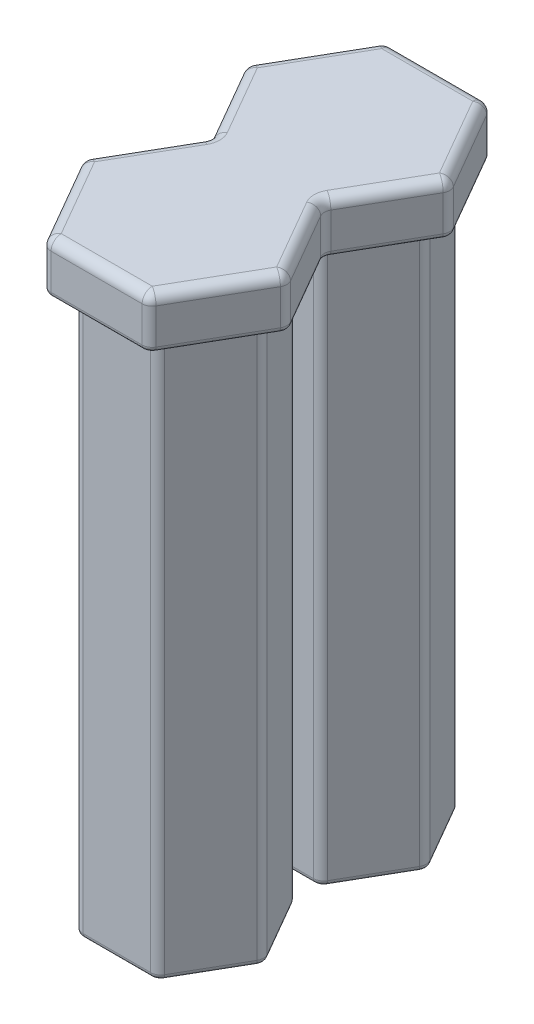
from build123d import *

# Parameters (mm, degrees)
BOSS_EXTRUDE1_DEPTH       = 55
BOSS_EXTRUDE1_2_DEPTH     = 55
BOSS_EXTRUDE2_START       = 55
BOSS_EXTRUDE2_DEPTH       = 5
FILLET1_R                 = 1
FILLET2_R                 = 1
F_4_0MM_DOWEL_HOLE1_D     = 4
F_4_0MM_DOWEL_HOLE1_DEPTH = 20
F_4_0MM_DOWEL_HOLE1_TIP   = 1.201721238
FILLET3_R                 = 0.5


with BuildPart() as part:
    # Sketch1 → Boss-Extrude1 (new body)
    with BuildSketch(Plane(origin=(0, 0, 0), x_dir=(1, 0, 0), z_dir=(0, 1, 0))):
        Polygon((-7.794228634, 0), (-3.897114317, -6.75), (3.897114317, -6.75), (7.794228634, 0), (3.897114317, 6.75), (-3.897114317, 6.75), align=None)
    extrude(amount=BOSS_EXTRUDE1_DEPTH)



with BuildPart() as body_2:
    # Sketch1 → Boss-Extrude1 2 (new body)
    with BuildSketch(Plane(origin=(0, 0, 0), x_dir=(1, 0, 0), z_dir=(0, 1, 0))):
        Polygon((3.897114317, 9.25), (7.794228634, 16), (3.897114317, 22.75), (-3.897114317, 22.75), (-7.794228634, 16), (-3.897114317, 9.25), align=None)
    extrude(amount=BOSS_EXTRUDE1_2_DEPTH)


with BuildPart() as part_1:
    add(part.part)

    add(body_2.part)  # Boss-Extrude2 merges body 2
    # Sketch1<4> → Boss-Extrude2 (add)
    # profile 1 of 3: a face of its own
    with BuildSketch(Plane(origin=(0, 0, 0), x_dir=(1, 0, 0), z_dir=(0, 1, 0)).offset(BOSS_EXTRUDE2_START)):
        Polygon((-5.051814855, 24.75), (-10.103629711, 16), (-5.484827557, 8), (-10.103629711, 0), (-5.051814855, -8.75), (5.051814855, -8.75), (10.103629711, 0), (5.484827557, 8), (10.103629711, 16), (5.051814855, 24.75), align=None)
        Polygon((-3.897114317, -6.75), (3.897114317, -6.75), (7.794228634, 0), (3.897114317, 6.75), (-3.897114317, 6.75), (-7.794228634, 0), align=None, mode=Mode.SUBTRACT)
        Polygon((-3.897114317, 9.25), (3.897114317, 9.25), (7.794228634, 16), (3.897114317, 22.75), (-3.897114317, 22.75), (-7.794228634, 16), align=None, mode=Mode.SUBTRACT)
    # profile 2 of 3: a face of its own
    with BuildSketch(Plane(origin=(0, 0, 0), x_dir=(1, 0, 0), z_dir=(0, 1, 0)).offset(BOSS_EXTRUDE2_START)):
        Polygon((-7.794228634, 16), (-3.897114317, 9.25), (3.897114317, 9.25), (7.794228634, 16), (3.897114317, 22.75), (-3.897114317, 22.75), align=None)
    # profile 3 of 3: a face of its own
    with BuildSketch(Plane(origin=(0, 0, 0), x_dir=(1, 0, 0), z_dir=(0, 1, 0)).offset(BOSS_EXTRUDE2_START)):
        Polygon((-7.794228634, 0), (-3.897114317, -6.75), (3.897114317, -6.75), (7.794228634, 0), (3.897114317, 6.75), (-3.897114317, 6.75), align=None)
    extrude(amount=BOSS_EXTRUDE2_DEPTH)

    # Fillet1
    fillet1_edges = [part_1.edges().sort_by_distance(p)[0] for p in [
        (7.794228634, 60, -4),
        (10.103629711, 57.5, 0),
        (7.794228634, 60, -12),
        (5.484827557, 57.5, -8),
        (7.577722283, 60, -20.375),
        (10.103629711, 57.5, -16),
        (0, 60, -24.75),
        (5.051814855, 57.5, -24.75),
        (-7.577722283, 60, -20.375),
        (-5.051814855, 57.5, -24.75),
        (-7.794228634, 60, -12),
        (-10.103629711, 57.5, -16),
        (-7.794228634, 60, -4),
        (-5.484827557, 57.5, -8),
        (-7.577722283, 60, 4.375),
        (-10.103629711, 57.5, 0),
        (0, 60, 8.75),
        (-5.051814855, 57.5, 8.75),
        (7.577722283, 60, 4.375),
        (5.051814855, 57.5, 8.75),
    ]]
    fillet(fillet1_edges, radius=FILLET1_R)

    # Fillet2
    fillet2_edges = [part_1.edges().sort_by_distance(p)[0] for p in [
        (-7.794228634, 27.5, 0),
        (-3.897114317, 27.5, -6.75),
        (3.897114317, 27.5, -6.75),
        (7.794228634, 27.5, 0),
        (3.897114317, 27.5, 6.75),
        (-3.897114317, 27.5, 6.75),
        (-3.897114317, 27.5, -9.25),
        (3.897114317, 27.5, -9.25),
        (7.794228634, 27.5, -16),
        (3.897114317, 27.5, -22.75),
        (-3.897114317, 27.5, -22.75),
        (-7.794228634, 27.5, -16),
    ]]
    fillet(fillet2_edges, radius=FILLET2_R)

    # Ø4.0mm Dowel Hole1
    with Locations(Plane(origin=(0, 0, 0), x_dir=(-1, 0, 0), z_dir=(0, -1, 0))):
        with Locations((0, 16), (0, 0)):
            Hole(F_4_0MM_DOWEL_HOLE1_D / 2, depth=F_4_0MM_DOWEL_HOLE1_DEPTH)
            with Locations((0, 0, -(F_4_0MM_DOWEL_HOLE1_DEPTH + F_4_0MM_DOWEL_HOLE1_TIP / 2))):  # 118° drill point
                Cone(0, F_4_0MM_DOWEL_HOLE1_D / 2, F_4_0MM_DOWEL_HOLE1_TIP, mode=Mode.SUBTRACT)

    # Fillet3
    fillet3_edges = [part_1.edges().sort_by_distance(p)[0] for p in [
        (7.794228634, 55, -12),
        (7.794228634, 55, -4),
        (-4.974464586, 55, -24.616025404),
        (4.974464586, 55, -24.616025404),
        (9.948929172, 55, -16),
        (9.948929172, 55, 0),
        (4.974464586, 55, 8.616025404),
        (-4.974464586, 55, 8.616025404),
        (-9.948929172, 55, 0),
        (-9.948929172, 55, -16),
        (-5.639528096, 55, -8),
        (5.639528096, 55, -8),
        (0, 0, -6.75),
        (0, 55, -6.75),
        (-5.845671476, 0, 3.375),
        (-5.845671476, 0, -3.375),
        (5.845671476, 0, -3.375),
        (5.845671476, 0, 3.375),
        (0, 0, 6.75),
        (-3.819764048, 0, -6.616025404),
        (-7.639528096, 0, 0),
        (-3.819764048, 0, 6.616025404),
        (3.819764048, 0, 6.616025404),
        (7.639528096, 0, 0),
        (3.819764048, 0, -6.616025404),
        (5.845671476, 55, -3.375),
        (5.845671476, 55, 3.375),
        (0, 55, 6.75),
        (-5.845671476, 55, 3.375),
        (-5.845671476, 55, -3.375),
        (0, 0, -9.25),
        (0, 55, -9.25),
        (-5.845671476, 0, -12.625),
        (-5.845671476, 0, -19.375),
        (0, 0, -22.75),
        (5.845671476, 0, -19.375),
        (5.845671476, 0, -12.625),
        (-7.639528096, 0, -16),
        (-3.819764048, 0, -22.616025404),
        (3.819764048, 0, -22.616025404),
        (7.639528096, 0, -16),
        (3.819764048, 0, -9.383974596),
        (-3.819764048, 0, -9.383974596),
        (-5.845671476, 55, -12.625),
        (5.845671476, 55, -12.625),
        (5.845671476, 55, -19.375),
        (0, 55, -22.75),
        (-5.845671476, 55, -19.375),
        (3.819764048, 55, -6.616025404),
        (7.639528096, 55, 0),
        (3.819764048, 55, 6.616025404),
        (-3.819764048, 55, 6.616025404),
        (-7.639528096, 55, 0),
        (-3.819764048, 55, -6.616025404),
        (-3.819764048, 55, -9.383974596),
        (3.819764048, 55, -9.383974596),
        (7.639528096, 55, -16),
        (3.819764048, 55, -22.616025404),
        (-3.819764048, 55, -22.616025404),
        (-7.639528096, 55, -16),
        (7.577722283, 55, 4.375),
        (0, 55, 8.75),
        (-7.577722283, 55, 4.375),
        (-7.794228634, 55, -4),
        (-7.794228634, 55, -12),
        (-7.577722283, 55, -20.375),
        (0, 55, -24.75),
        (7.577722283, 55, -20.375),
    ]]
    fillet(fillet3_edges, radius=FILLET3_R)


solid = part_1.part
